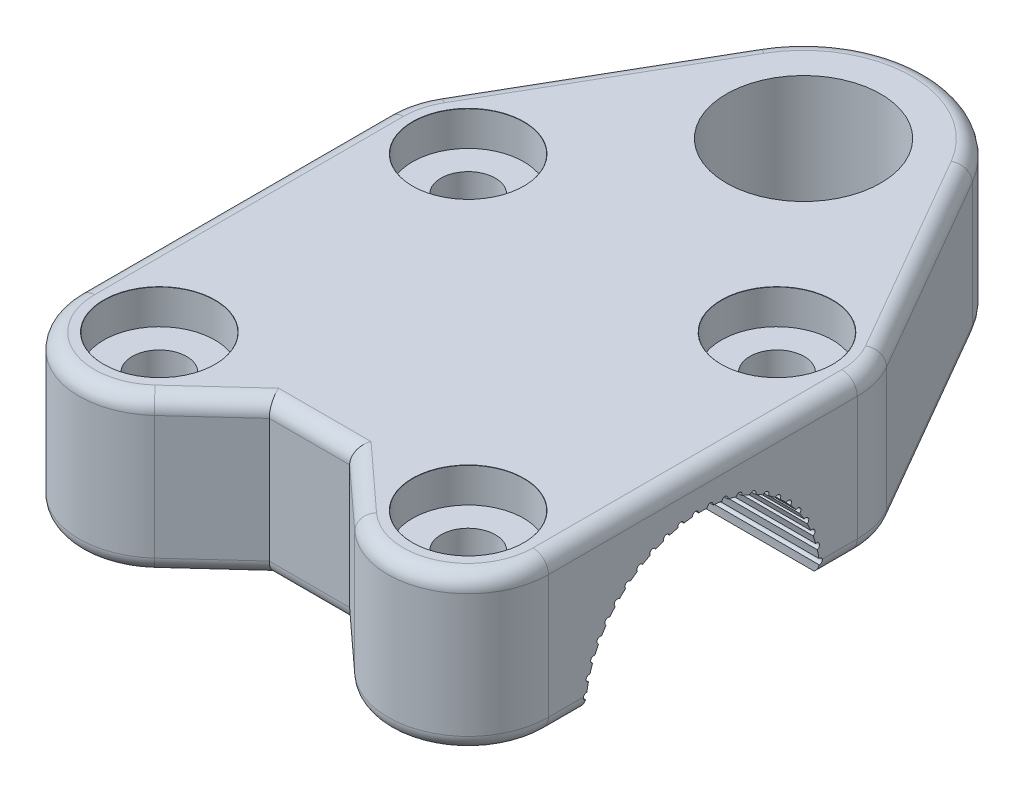
from build123d import *

# Parameters (mm, degrees)
BOSS_EXTRUDE1_DEPTH     = 25
LPATTERN1_COUNT         = 2
LPATTERN1_PITCH         = 50
LPATTERN1_COUNT_DIR2    = 2
LPATTERN1_PITCH_DIR2    = 50
SKETCH3_R               = 12.5
CUT_EXTRUDE1_DEPTH      = 110.859000542
CUT_EXTRUDE2_DEPTH      = 129.066389033
CUT_EXTRUDE2_DEPTH_BACK = 129.066389033
SKETCH5_R               = 0.5
CUT_EXTRUDE3_DEPTH      = 129.066389033
CIRPATTERN1_COUNT       = 26
CIRPATTERN1_ANGLE       = 180
FILLET4_R               = 2.5
FILLET5_R               = 2.5


with BuildPart() as part:
    # Sketch1 → Boss-Extrude1 (new body)
    with BuildSketch(Plane(origin=(0, 0, 0), x_dir=(1, 0, 0), z_dir=(0, 1, 0))):
        with BuildLine():
            Line((6.5, 0), (-6.5, 0))
            Line((-6.5, 0), (-16.22720919, -8.894921288))
            ThreePointArc((-16.22720919, -8.894921288), (-30.241837439, -11.197620061), (-38, 0.698729811))
            Line((-38, 0.698729811), (-38, 50.698729811))
            ThreePointArc((-38, 50.698729811), (-37.557035742, 54.063377397), (-36.258330249, 57.198729811))
            Line((-36.258330249, 57.198729811), (-17.320508076, 90))
            ThreePointArc((-17.320508076, 90), (0, 100), (17.320508076, 90))
            Line((17.320508076, 90), (36.258330249, 57.198729811))
            ThreePointArc((36.258330249, 57.198729811), (37.557035742, 54.063377397), (38, 50.698729811))
            Line((38, 50.698729811), (38, 0.698729811))
            ThreePointArc((38, 0.698729811), (30.241837439, -11.197620061), (16.22720919, -8.894921288))
            Line((16.22720919, -8.894921288), (6.5, 0))
        make_face()
    extrude(amount=BOSS_EXTRUDE1_DEPTH)

    # Sketch2 → CBORE for M8 Hex Head Bolt1 (revolve, cut)
    with BuildSketch(Plane(origin=(-25, 25, -0.698729811), x_dir=(0, 0, 1), z_dir=(1, 0, 0))):
        Polygon((0, 0), (0, 25), (4.4, 25), (4.4, 5.6), (9, 5.6), (9, 0.03), (9.03, 0), align=None)
    cbore_for_m8_hex_head_bolt1 = revolve(axis=Axis((-25, 31.35, -0.698729811), (0, -1, 0)), mode=Mode.SUBTRACT)

    # LPattern1: CBORE for M8 Hex Head Bolt1 2 × 2
    with Locations(*[(i * LPATTERN1_PITCH, 0, -j * LPATTERN1_PITCH_DIR2) for i in range(LPATTERN1_COUNT) for j in range(LPATTERN1_COUNT_DIR2) if (i, j) != (0, 0)]):
        add(cbore_for_m8_hex_head_bolt1, mode=Mode.SUBTRACT)

    # Sketch3 → Cut-Extrude1 (cut, through all)
    with BuildSketch(Plane(origin=(0, 25, 0), x_dir=(1, 0, 0), z_dir=(0, 1, 0))):
        with Locations(Location((0, 80, 0), (0, 0, 270))):
            Circle(SKETCH3_R)
    extrude(amount=-CUT_EXTRUDE1_DEPTH, mode=Mode.SUBTRACT)

    # Sketch4 → Cut-Extrude2 (cut, two sides: drawn at the far end of the back side and taken through both)
    with BuildSketch(Plane(origin=(38, 0, 0), x_dir=(0, 0, -1), z_dir=(1, 0, 0)).offset(-CUT_EXTRUDE2_DEPTH_BACK)):
        with BuildLine():
            Line((44.698729811, -203.185165258), (44.698729811, 0))
            ThreePointArc((44.698729811, 0), (25.698729811, 19), (6.698729811, 0))
            Line((6.698729811, 0), (6.698729811, -203.185165258))
            Line((6.698729811, -203.185165258), (6.698729811, -609.555495773))
            Line((6.698729811, -609.555495773), (44.698729811, -609.555495773))
            Line((44.698729811, -609.555495773), (44.698729811, -203.185165258))
        make_face()
    extrude(amount=CUT_EXTRUDE2_DEPTH + CUT_EXTRUDE2_DEPTH_BACK, mode=Mode.SUBTRACT)

    # Sketch5 → Cut-Extrude3 (cut, through all)
    with BuildSketch(Plane(origin=(38, 0, 0), x_dir=(0, 0, -1), z_dir=(1, 0, 0))):
        with Locations((6.698729811, 0)):
            Circle(SKETCH5_R)
    cut_extrude3 = extrude(amount=-CUT_EXTRUDE3_DEPTH, mode=Mode.SUBTRACT)

    # CirPattern1: Cut-Extrude3 ×26 about axis
    cirpattern1_axis = Axis((0, 0, -25.698729811), (-1, 0, 0))
    for i in range(1, CIRPATTERN1_COUNT):
        add(cut_extrude3.rotate(cirpattern1_axis, i * CIRPATTERN1_ANGLE / (CIRPATTERN1_COUNT - 1)), mode=Mode.SUBTRACT)

    # Fillet4
    fillet4_edges = [part.edges().sort_by_distance(p)[0] for p in [
        (11.363604595, 25, 4.447460644),
        (30.241837439, 25, 11.197620061),
        (38, 25, -25.698729811),
        (37.557035742, 25, -54.063377397),
        (26.789419162, 25, -73.599364905),
        (0, 25, -100),
        (-26.789419162, 25, -73.599364905),
        (-37.557035742, 25, -54.063377397),
        (-38, 25, -25.698729811),
        (-30.241837439, 25, 11.197620061),
        (-11.363604595, 25, 4.447460644),
        (0, 25, 0),
    ]]
    fillet(fillet4_edges, radius=FILLET4_R)

    # Fillet5
    fillet5_edges = [part.edges().sort_by_distance(p)[0] for p in [
        (38, 0, -47.948729811),
        (37.557035742, 0, -54.063377397),
        (-38, 0, -47.948729811),
        (-37.557035742, 0, -54.063377397),
        (-26.789419162, 0, -73.599364905),
        (0, 0, -100),
        (-38, 0, -3.448729811),
        (-30.241837439, 0, 11.197620061),
        (38, 0, -3.448729811),
        (30.241837439, 0, 11.197620061),
        (26.789419162, 0, -73.599364905),
        (-11.363604595, 0, 4.447460644),
        (11.363604595, 0, 4.447460644),
        (0, 0, 0),
    ]]
    fillet(fillet5_edges, radius=FILLET5_R)


solid = part.part
